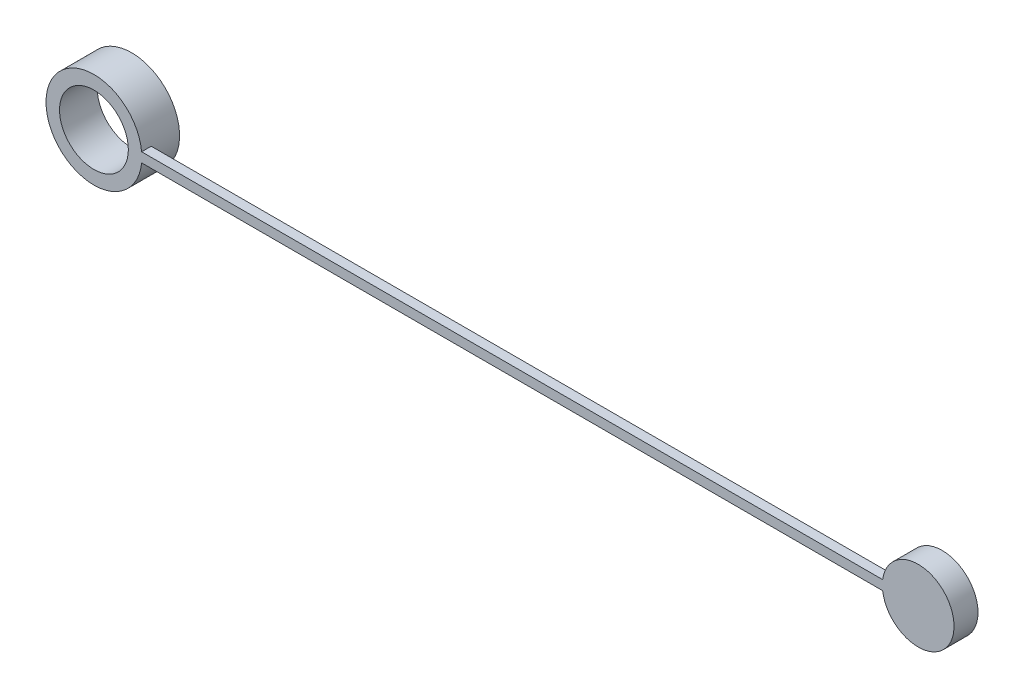
from build123d import *

# Parameters (mm, degrees)
SKETCH4_W                = 85.972725278
SKETCH4_H                = 1
EXTRUDE_THIN1_DEPTH      = 0.5
SKETCH6_R                = 5
CUT_EXTRUDE1_DEPTH       = 10
BOSS_EXTRUDE2_DEPTH      = 0.5
BOSS_EXTRUDE2_DEPTH_BACK = 5
SKETCH7_R                = 3.739985504
BOSS_EXTRUDE3_START      = -0.5
SKETCH8_R                = 5
SKETCH8_R_2              = 3
BOSS_EXTRUDE3_DEPTH      = 1
MOVE_FACE1_BY            = 2
SKETCH10_R               = 3.589046815
CUT_EXTRUDE4_DEPTH       = 1
MOVE_FACE2_BY            = 5
SKETCH11_R               = 5
SKETCH11_R_2             = 3.589046815
BOSS_EXTRUDE4_DEPTH      = 2.93


with BuildPart() as part:
    # Sketch4 → Extrude-Thin1 (new, symmetric)
    with BuildSketch(Plane.XY):
        with Locations((71.721545049, 0)):
            Rectangle(SKETCH4_W, SKETCH4_H)
    extrude(amount=EXTRUDE_THIN1_DEPTH, both=True)

    # Sketch6 → Cut-Extrude1 (cut)
    with BuildSketch(Plane.XY.offset(0.5)):
        with Locations((28.73518241, 0)):
            Circle(SKETCH6_R)
    extrude(amount=-CUT_EXTRUDE1_DEPTH, mode=Mode.SUBTRACT)

    # Sketch7 → Boss-Extrude2 (add, two sides: drawn at the far end of the back side and taken through both)
    with BuildSketch(Plane.XY.offset(-BOSS_EXTRUDE2_DEPTH_BACK)):
        with Locations(Location((114.707907688, 0, 0), (0, 0, 187.682896446))):
            Circle(SKETCH7_R)
    extrude(amount=BOSS_EXTRUDE2_DEPTH + BOSS_EXTRUDE2_DEPTH_BACK)

    # Sketch8 → Boss-Extrude3 (add)
    with BuildSketch(Plane.XY.offset(BOSS_EXTRUDE3_START)):
        with Locations((28.73518241, 0)):
            Circle(SKETCH8_R)
        with Locations((28.73518241, 0)):
            Circle(SKETCH8_R_2, mode=Mode.SUBTRACT)
    extrude(amount=BOSS_EXTRUDE3_DEPTH)

    # Move Face1: a face moved outward by 2.0
    extrude(part.faces().sort_by_distance((114.707907688, 0, -5))[0], amount=MOVE_FACE1_BY, dir=(0, 0, -1))

    # Sketch10 → Cut-Extrude4 (cut)
    with BuildSketch(Plane.XY.offset(0.5)):
        with Locations((28.73518241, 0)):
            Circle(SKETCH10_R)
    extrude(amount=-CUT_EXTRUDE4_DEPTH, mode=Mode.SUBTRACT)

    # Move Face2: a face moved inward by 5.0
    extrude(part.faces().sort_by_distance((114.707907688, 0, -7))[0], amount=MOVE_FACE2_BY, dir=(0, 0, 1), mode=Mode.SUBTRACT)

    # Sketch11 → Boss-Extrude4 (add)
    with BuildSketch(Plane(origin=(0, 0, -0.5), x_dir=(-1, 0, 0), z_dir=(0, 0, -1))):
        with Locations((-28.73518241, 0)):
            Circle(SKETCH11_R)
        with Locations(Location((-28.73518241, 0, 0), (0, 0, 180))):
            Circle(SKETCH11_R_2, mode=Mode.SUBTRACT)
    extrude(amount=BOSS_EXTRUDE4_DEPTH)


solid = part.part
